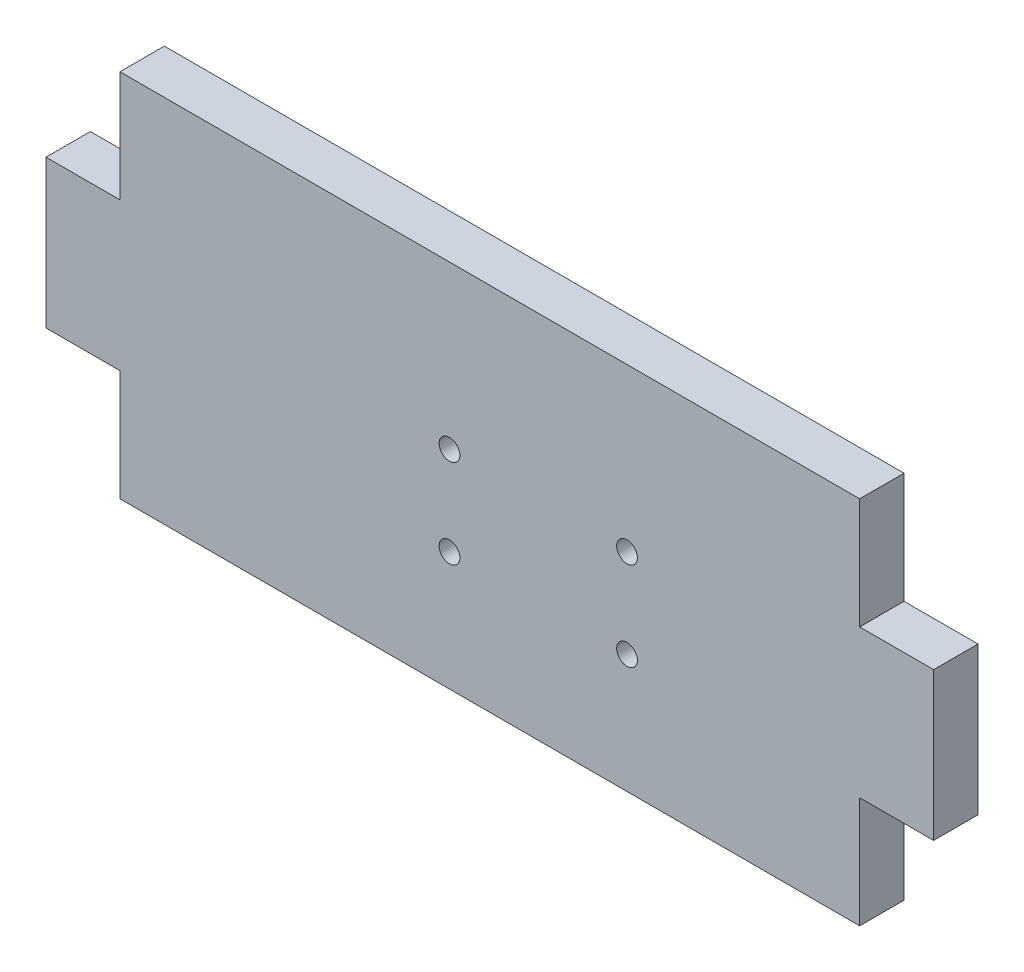
from build123d import *

# Parameters (mm, degrees)
ESQUISSE1_W             = 10
ESQUISSE1_H             = 20
ESQUISSE1_W_2           = 100
ESQUISSE1_H_2           = 50
BOSS_EXTRU_1_DEPTH      = 6
ESQUISSE2_R             = 1.4
ENL_V_MAT_EXTRU_1_DEPTH = 6
ESQUISSE3_R             = 3
ENL_V_MAT_EXTRU_2_DEPTH = 4


with BuildPart() as part:
    # Esquisse1 → Boss.-Extru.1 (new body)
    with BuildSketch(Plane.XY):
        with Locations((-5, 25)):
            Rectangle(ESQUISSE1_W, ESQUISSE1_H)
        with Locations((50, 25)):
            Rectangle(ESQUISSE1_W_2, ESQUISSE1_H_2)
        with Locations((105, 25)):
            Rectangle(ESQUISSE1_W, ESQUISSE1_H)
    extrude(amount=BOSS_EXTRU_1_DEPTH)

    # Esquisse2 → Enlèv. mat.-Extru.1 (cut)
    with BuildSketch(Plane(origin=(0, 0, 0), x_dir=(-1, 0, 0), z_dir=(0, 0, -1))):
        with Locations((-44.550340057, 16.065313345)):
            Circle(ESQUISSE2_R)
        with Locations((-44.550340057, 28.065313345)):
            Circle(ESQUISSE2_R)
        with Locations((-68.550340057, 28.065313345)):
            Circle(ESQUISSE2_R)
        with Locations((-68.550340057, 16.065313345)):
            Circle(ESQUISSE2_R)
    extrude(amount=-ENL_V_MAT_EXTRU_1_DEPTH, mode=Mode.SUBTRACT)

    # Esquisse3 → Enlèv. mat.-Extru.2 (cut)
    with BuildSketch(Plane(origin=(0, 0, 0), x_dir=(-1, 0, 0), z_dir=(0, 0, -1))):
        with Locations((-68.550340057, 28.065313345)):
            Circle(ESQUISSE3_R)
        with Locations((-44.550340057, 28.065313345)):
            Circle(ESQUISSE3_R)
        with Locations((-44.550340057, 16.065313345)):
            Circle(ESQUISSE3_R)
        with Locations((-68.550340057, 16.065313345)):
            Circle(ESQUISSE3_R)
    extrude(amount=-ENL_V_MAT_EXTRU_2_DEPTH, mode=Mode.SUBTRACT)


solid = part.part
